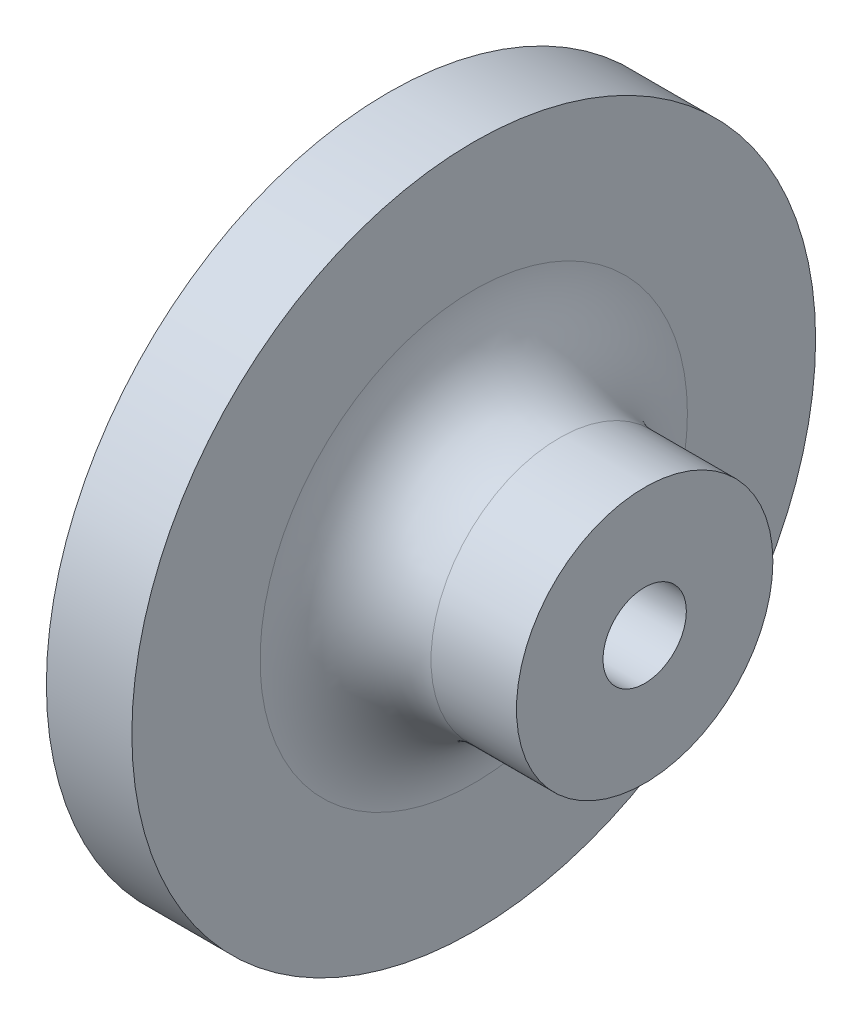
from build123d import *

# Parameters (mm, degrees)
ESQUISSE1_R             = 40
ESQUISSE1_R_2           = 5.5
BOSS_EXTRU_1_DEPTH      = 10
BOSS_EXTRU_2_START      = -7
ESQUISSE2_R             = 40
BOSS_EXTRU_2_DEPTH      = 7
ESQUISSE3_R             = 15
BOSS_EXTRU_3_DEPTH      = 20
CONG_1_R                = 10
ESQUISSE4_R             = 4.875
ENL_V_MAT_EXTRU_1_DEPTH = 16


with BuildPart() as part:
    # Esquisse1 → Boss.-Extru.1 (new body)
    with BuildSketch(Plane.YZ):
        with Locations(Location((0, 0, 0), (0, 0, 270))):
            Circle(ESQUISSE1_R)
        with Locations(Location((0, 32, 0), (0, 0, 270))):
            Circle(ESQUISSE1_R_2, mode=Mode.SUBTRACT)
        with Locations(Location((12.245869836, 29.56414504, 0), (0, 0, 270))):
            Circle(ESQUISSE1_R_2, mode=Mode.SUBTRACT)
        with Locations(Location((22.627416998, 22.627416998, 0), (0, 0, 270))):
            Circle(ESQUISSE1_R_2, mode=Mode.SUBTRACT)
        with Locations(Location((29.56414504, 12.245869836, 0), (0, 0, 270))):
            Circle(ESQUISSE1_R_2, mode=Mode.SUBTRACT)
        with Locations(Location((32, 0, 0), (0, 0, 270))):
            Circle(ESQUISSE1_R_2, mode=Mode.SUBTRACT)
        with Locations(Location((29.56414504, -12.245869836, 0), (0, 0, 270))):
            Circle(ESQUISSE1_R_2, mode=Mode.SUBTRACT)
        with Locations(Location((22.627416998, -22.627416998, 0), (0, 0, 270))):
            Circle(ESQUISSE1_R_2, mode=Mode.SUBTRACT)
        with Locations(Location((12.245869836, -29.56414504, 0), (0, 0, 270))):
            Circle(ESQUISSE1_R_2, mode=Mode.SUBTRACT)
        with Locations(Location((0, -32, 0), (0, 0, 270))):
            Circle(ESQUISSE1_R_2, mode=Mode.SUBTRACT)
        with Locations(Location((-12.245869836, -29.56414504, 0), (0, 0, 270))):
            Circle(ESQUISSE1_R_2, mode=Mode.SUBTRACT)
        with Locations(Location((-22.627416998, -22.627416998, 0), (0, 0, 270))):
            Circle(ESQUISSE1_R_2, mode=Mode.SUBTRACT)
        with Locations(Location((-29.56414504, -12.245869836, 0), (0, 0, 270))):
            Circle(ESQUISSE1_R_2, mode=Mode.SUBTRACT)
        with Locations(Location((-32, 0, 0), (0, 0, 270))):
            Circle(ESQUISSE1_R_2, mode=Mode.SUBTRACT)
        with Locations(Location((-29.56414504, 12.245869836, 0), (0, 0, 270))):
            Circle(ESQUISSE1_R_2, mode=Mode.SUBTRACT)
        with Locations(Location((-22.627416998, 22.627416998, 0), (0, 0, 270))):
            Circle(ESQUISSE1_R_2, mode=Mode.SUBTRACT)
        with Locations(Location((-12.245869836, 29.56414504, 0), (0, 0, 270))):
            Circle(ESQUISSE1_R_2, mode=Mode.SUBTRACT)
        with Locations(Location((-11.429260712, 17.105097445, 0), (0, 0, 270))):
            Circle(ESQUISSE1_R_2, mode=Mode.SUBTRACT)
        with Locations(Location((4.013422643, 20.17683815, 0), (0, 0, 270))):
            Circle(ESQUISSE1_R_2, mode=Mode.SUBTRACT)
        with Locations(Location((17.105097445, 11.429260712, 0), (0, 0, 270))):
            Circle(ESQUISSE1_R_2, mode=Mode.SUBTRACT)
        with Locations(Location((20.17683815, -4.013422643, 0), (0, 0, 270))):
            Circle(ESQUISSE1_R_2, mode=Mode.SUBTRACT)
        with Locations(Location((11.429260712, -17.105097445, 0), (0, 0, 270))):
            Circle(ESQUISSE1_R_2, mode=Mode.SUBTRACT)
        with Locations(Location((-4.013422643, -20.17683815, 0), (0, 0, 270))):
            Circle(ESQUISSE1_R_2, mode=Mode.SUBTRACT)
        with Locations(Location((-17.105097445, -11.429260712, 0), (0, 0, 270))):
            Circle(ESQUISSE1_R_2, mode=Mode.SUBTRACT)
        with Locations(Location((-20.17683815, 4.013422643, 0), (0, 0, 270))):
            Circle(ESQUISSE1_R_2, mode=Mode.SUBTRACT)
        with Locations(Location((5.527683242, 8.272762594, 0), (0, 0, 270))):
            Circle(ESQUISSE1_R_2, mode=Mode.SUBTRACT)
        with Locations(Location((8.272762594, -5.527683242, 0), (0, 0, 270))):
            Circle(ESQUISSE1_R_2, mode=Mode.SUBTRACT)
        with Locations(Location((-5.527683242, -8.272762594, 0), (0, 0, 270))):
            Circle(ESQUISSE1_R_2, mode=Mode.SUBTRACT)
        with Locations(Location((-8.272762594, 5.527683242, 0), (0, 0, 270))):
            Circle(ESQUISSE1_R_2, mode=Mode.SUBTRACT)
    extrude(amount=BOSS_EXTRU_1_DEPTH)

    # Esquisse2 → Boss.-Extru.2 (add)
    with BuildSketch(Plane.YZ.offset(10).offset(BOSS_EXTRU_2_START)):
        with Locations(Location((0, 0, 0), (0, 0, 270))):
            Circle(ESQUISSE2_R)
    extrude(amount=BOSS_EXTRU_2_DEPTH)

    # Esquisse3 → Boss.-Extru.3 (add)
    with BuildSketch(Plane.YZ.offset(10)):
        with Locations(Location((0, 0, 0), (0, 0, 270))):
            Circle(ESQUISSE3_R)
    extrude(amount=BOSS_EXTRU_3_DEPTH)

    # Congé1
    cong_1_edges = [part.edges().sort_by_distance(p)[0] for p in [
        (10, 0, 15),
    ]]
    fillet(cong_1_edges, radius=CONG_1_R)

    # Esquisse4 → Enlèv. mat.-Extru.1 (cut)
    with BuildSketch(Plane.YZ.offset(30)):
        with Locations(Location((0, 0, 0), (0, 0, 270))):
            Circle(ESQUISSE4_R)
    extrude(amount=-ENL_V_MAT_EXTRU_1_DEPTH, mode=Mode.SUBTRACT)


solid = part.part
